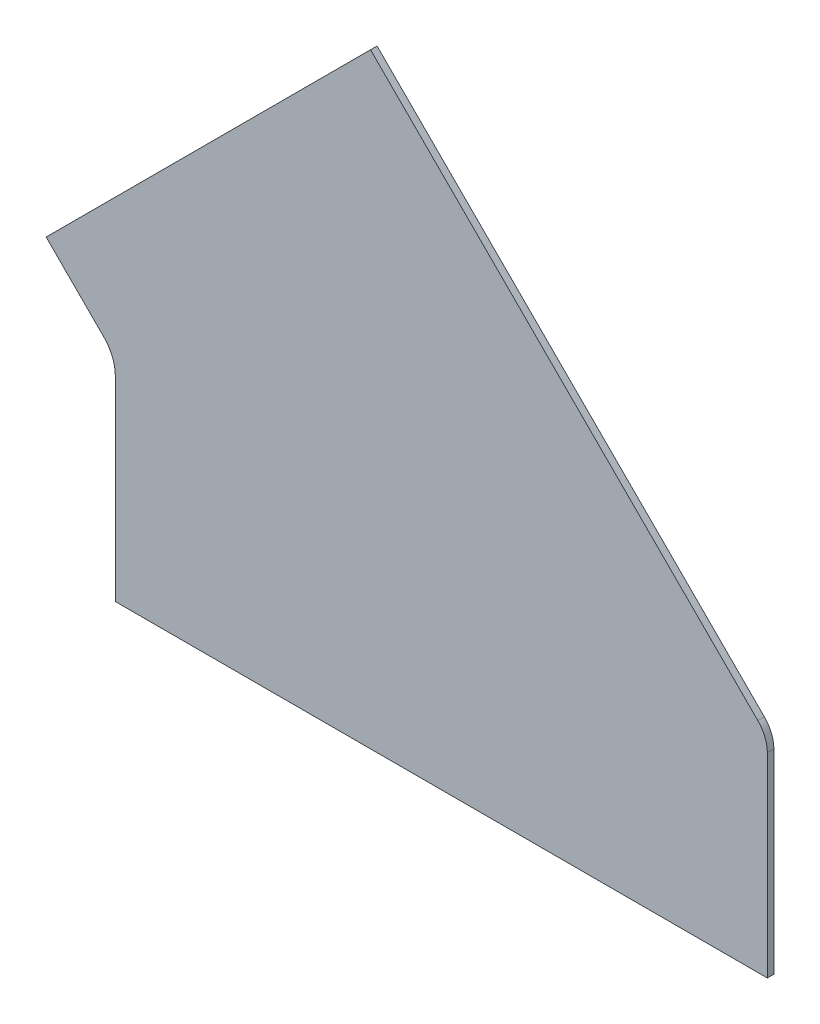
from build123d import *

# Parameters (mm, degrees)
EXTRUDE_2_DEPTH = 2
FILLET_1_R      = 10
FILLET_2_R      = 12


with BuildPart() as part:
    # Эскиз2 → Бобышка-Вытянуть2 (new body)
    with BuildSketch(Plane.XY):
        Polygon((0, 0), (200, 0), (200, 64), (78.286796564, 185.713203436), (-21.213203436, 86.213203436), (0, 65), align=None)
    extrude(amount=EXTRUDE_2_DEPTH)

    # Скругление1
    fillet_1_edges = [part.edges().sort_by_distance(p)[0] for p in [
        (200, 64, 1),
    ]]
    fillet(fillet_1_edges, radius=FILLET_1_R)

    # Скругление2
    fillet_2_edges = [part.edges().sort_by_distance(p)[0] for p in [
        (0, 65, 1),
    ]]
    fillet(fillet_2_edges, radius=FILLET_2_R)


solid = part.part
